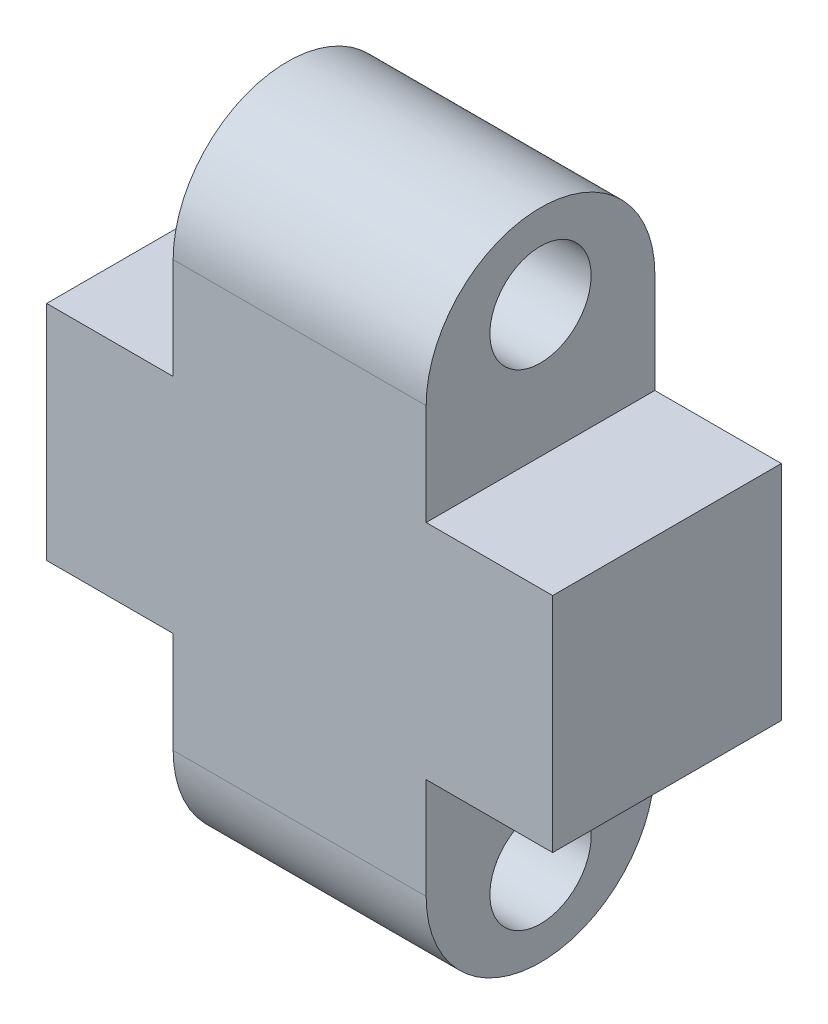
from build123d import *

# Parameters (mm, degrees)
SKETCH1_W           = 50
SKETCH1_H           = 22
BOSS_EXTRUDE1_DEPTH = 22.6
SKETCH3_R           = 5
BOSS_EXTRUDE2_DEPTH = 12.5


with BuildPart() as part:
    # Sketch1 → Boss-Extrude1 (new body)
    with BuildSketch(Plane.XY):
        Rectangle(SKETCH1_W, SKETCH1_H)
    extrude(amount=BOSS_EXTRUDE1_DEPTH)

    # Sketch3 → Boss-Extrude2 (add, symmetric)
    with BuildSketch(Plane(origin=(0, 0, 0), x_dir=(0, 0, -1), z_dir=(1, 0, 0))):
        with BuildLine():
            Line((-22.6, 11), (-22.6, 21))
            ThreePointArc((-22.6, 21), (-11.3, 32.3), (0, 21))
            Line((0, 21), (0, 11))
            Line((0, 11), (-22.6, 11))
        make_face()
        with Locations((-11.3, 24)):
            Circle(SKETCH3_R, mode=Mode.SUBTRACT)
    boss_extrude2 = extrude(amount=BOSS_EXTRUDE2_DEPTH, both=True)

    # Mirror1: Boss-Extrude2 across plane
    add(boss_extrude2.mirror(Plane.ZX))


solid = part.part
